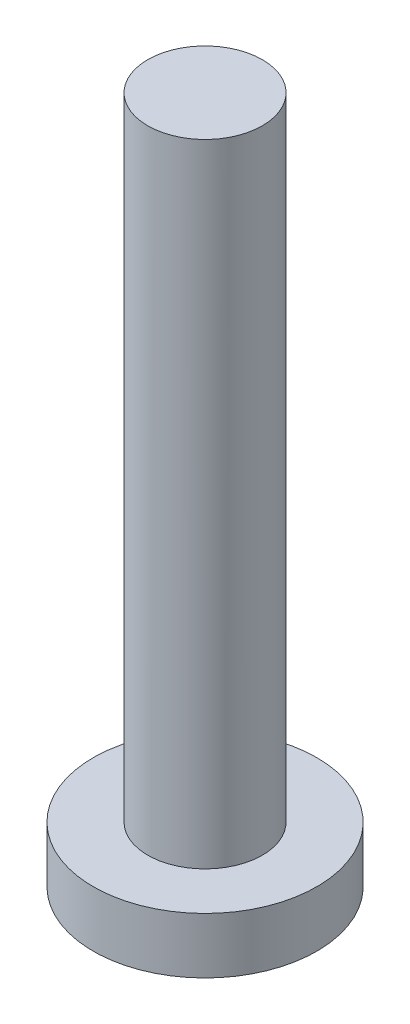
from build123d import *

# Parameters (mm, degrees)
SKETCH1_R           = 1.025
BOSS_EXTRUDE1_DEPTH = 11.3
SKETCH2_R           = 2
BOSS_EXTRUDE2_DEPTH = 1


with BuildPart() as part:
    # Sketch1 → Boss-Extrude1 (new body)
    with BuildSketch(Plane(origin=(0, 0, 0), x_dir=(1, 0, 0), z_dir=(0, 1, 0))):
        with Locations(Location((0, 0, 0), (0, 0, 270))):
            Circle(SKETCH1_R)
    extrude(amount=BOSS_EXTRUDE1_DEPTH)

    # Sketch2 → Boss-Extrude2 (add)
    with BuildSketch(Plane.XZ):
        with Locations(Location((0, 0, 0), (0, 0, 270))):
            Circle(SKETCH2_R)
    extrude(amount=BOSS_EXTRUDE2_DEPTH)


solid = part.part
